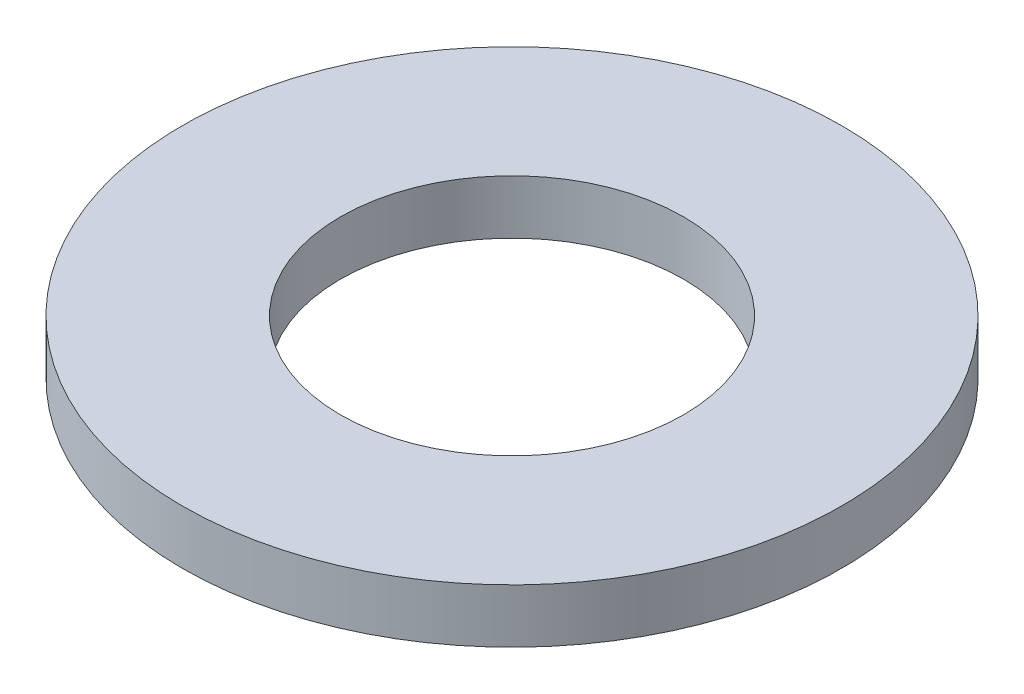
from build123d import *

# Parameters (mm, degrees)
SKETCH1_R           = 12.2
SKETCH1_R_2         = 6.35
BOSS_EXTRUDE1_DEPTH = 2


with BuildPart() as part:
    # Sketch1 → Boss-Extrude1 (new body)
    with BuildSketch(Plane(origin=(0, 0, 0), x_dir=(1, 0, 0), z_dir=(0, 1, 0))):
        with Locations(Location((0, 0, 0), (0, 0, 270))):
            Circle(SKETCH1_R)
        with Locations(Location((0, 0, 0), (0, 0, 270))):
            Circle(SKETCH1_R_2, mode=Mode.SUBTRACT)
    extrude(amount=BOSS_EXTRUDE1_DEPTH)


solid = part.part
